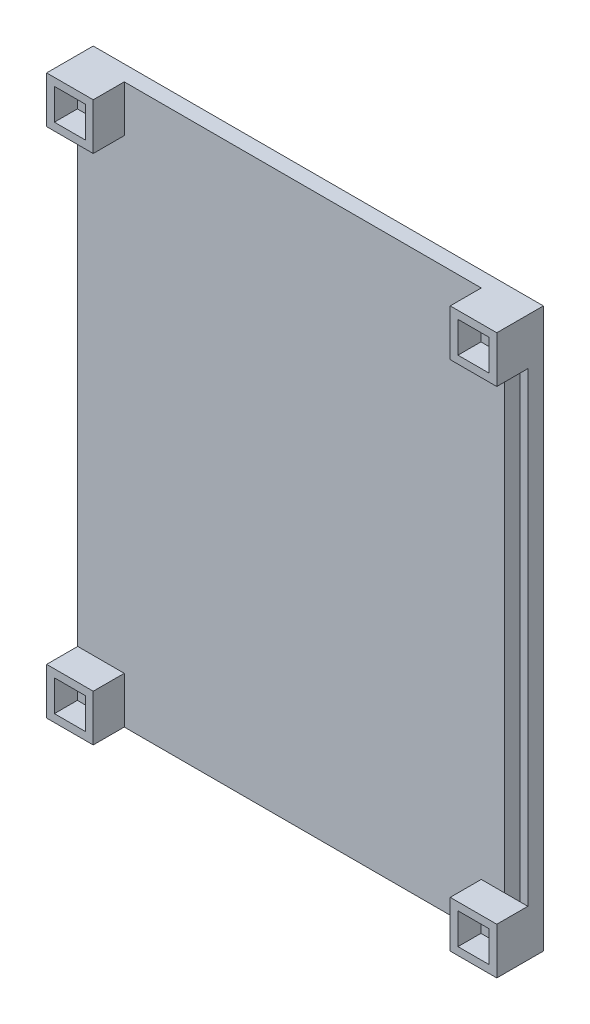
from build123d import *

# Parameters (mm, degrees)
SKETCH1_W           = 368.3
SKETCH1_H           = 457.2
BOSS_EXTRUDE1_DEPTH = 12.7
SKETCH2_W           = 38.1
SKETCH2_H           = 38.1
BOSS_EXTRUDE2_DEPTH = 25.4
SKETCH3_W           = 25.4
SKETCH3_H           = 25.4
CUT_EXTRUDE1_DEPTH  = 18.796
SKETCH4_W           = 12.7
SKETCH4_H           = 406.4
CUT_EXTRUDE2_DEPTH  = 12.7


with BuildPart() as part:
    # Sketch1 → Boss-Extrude1 (new body)
    with BuildSketch(Plane.XY):
        Rectangle(SKETCH1_W, SKETCH1_H)
    extrude(amount=BOSS_EXTRUDE1_DEPTH)

    # Sketch2 → Boss-Extrude2 (add)
    with BuildSketch(Plane.XY.offset(12.7)):
        with Locations((-165.1, 209.55)):
            Rectangle(SKETCH2_W, SKETCH2_H)
        with Locations((-165.1, -209.55)):
            Rectangle(SKETCH2_W, SKETCH2_H)
        with Locations((165.1, -209.55)):
            Rectangle(SKETCH2_W, SKETCH2_H)
        with Locations((165.1, 209.55)):
            Rectangle(SKETCH2_W, SKETCH2_H)
    extrude(amount=BOSS_EXTRUDE2_DEPTH)

    # Sketch3 → Cut-Extrude1 (cut)
    with BuildSketch(Plane.XY.offset(38.1)):
        with Locations((-165.1, 209.55)):
            Rectangle(SKETCH3_W, SKETCH3_H)
        with Locations((165.1, -209.55)):
            Rectangle(SKETCH3_W, SKETCH3_H)
        with Locations((165.1, 209.55)):
            Rectangle(SKETCH3_W, SKETCH3_H)
        with Locations((-165.1, -209.55)):
            Rectangle(SKETCH3_W, SKETCH3_H)
    extrude(amount=-CUT_EXTRUDE1_DEPTH, mode=Mode.SUBTRACT)

    # Sketch4 → Cut-Extrude2 (cut)
    with BuildSketch(Plane(origin=(0, 0, 0), x_dir=(-1, 0, 0), z_dir=(0, 0, -1))):
        with Locations((-171.45, 0)):
            Rectangle(SKETCH4_W, SKETCH4_H)
    extrude(amount=-CUT_EXTRUDE2_DEPTH, mode=Mode.SUBTRACT)


solid = part.part
